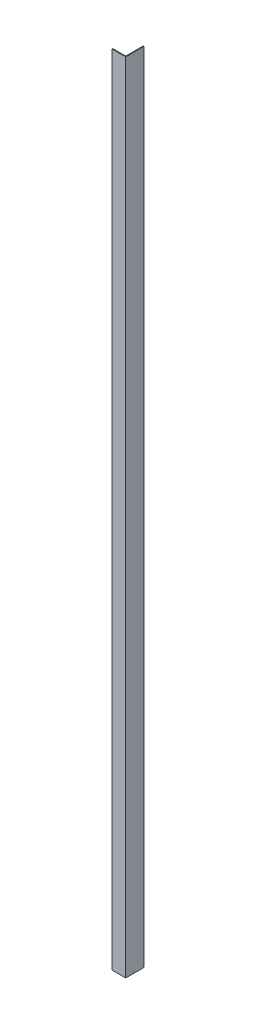
from build123d import *

# Parameters (mm, degrees)
TOPPING_SOVE_SOL_1_START = 200
TOPPING_SOVE_SOL_1_DEPTH = 1770


with BuildPart() as part:
    # Sketch1 → TOPPING_sove_sol_1 (new body)
    with BuildSketch(Plane(origin=(0, 0, 0), x_dir=(1, 0, 0), z_dir=(0, 1, 0)).offset(TOPPING_SOVE_SOL_1_START)):
        Polygon((0, -40), (0, -38.5), (28.5, -38.5), (28.5, 0), (30, 0), (30, -40), align=None)
    extrude(amount=TOPPING_SOVE_SOL_1_DEPTH)


solid = part.part
